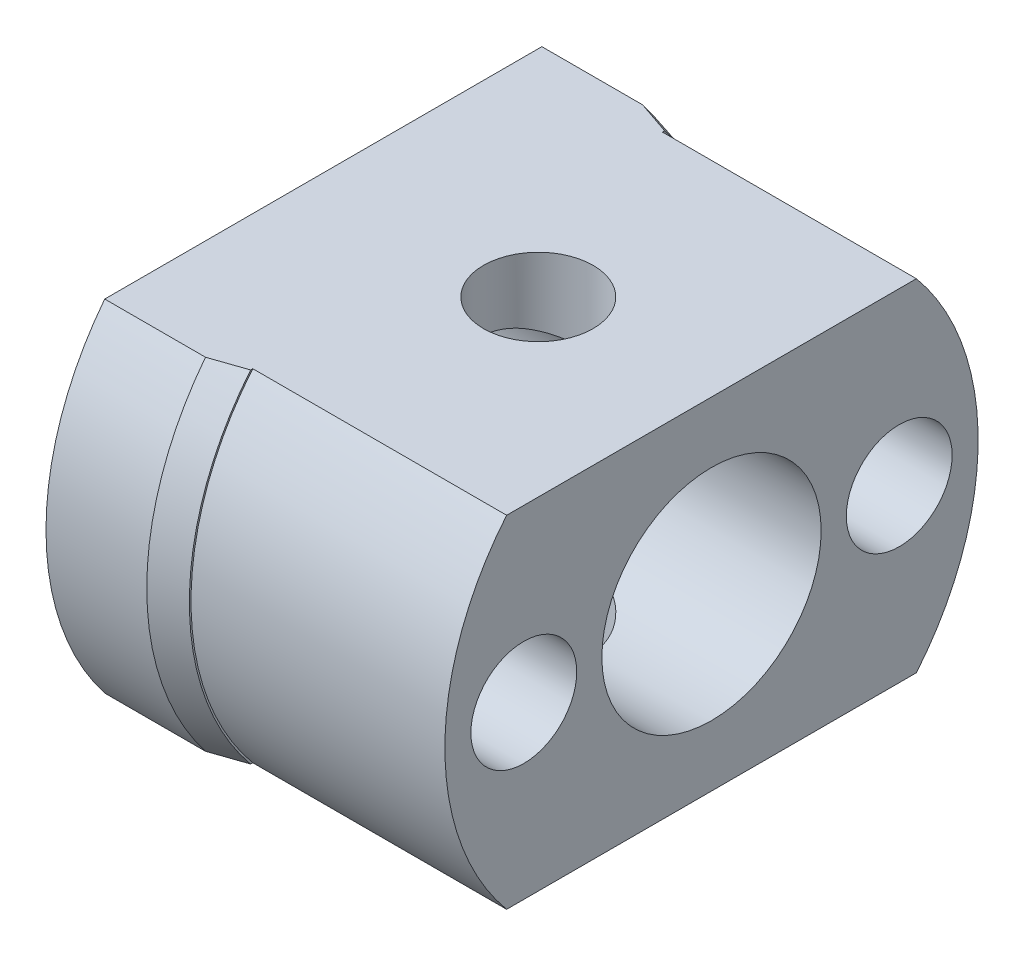
from build123d import *

# Parameters (mm, degrees)
SKETCH1_R                 = 7.9375
SKETCH1_R_2               = 1.575
SKETCH1_R_3               = 3.2639
INNER_SIDE_EXTRUDE_DEPTH  = 2.032
OUTER_START               = -9.525
SKETCH1_3_R               = 7.9375
SKETCH1_3_R_2             = 1.575
SKETCH1_3_R_3             = 3.2639
OUTER_SIDE_EXTRUDE_DEPTH  = 9.525
CLEVIS_PIN_CUT_DEPTH      = 15.721869362
CLEVIS_PIN_CUT_DEPTH_BACK = 15.721869362
SKETCH2_R                 = 1.63195
SKETCH3_R                 = 8.255
SKETCH3_R_2               = 7.9375
BOSS_EXTRUDE1_DEPTH       = 4
SKETCH4_R                 = 1.575
CUT_EXTRUDE1_DEPTH        = 4
CHAMFER1_SIZE             = 1
CHAMFER1_SIZE2            = 0.267949192
CUT_EXTRUDE2_DEPTH        = 16.067039421
CUT_EXTRUDE2_DEPTH_BACK   = 16.067039421
SKETCH5_W                 = 16.51
SKETCH5_H                 = 4.312866645


with BuildPart() as part:
    # Sketch1 → Inner Side Extrude (new body)
    with BuildSketch(Plane(origin=(0, 0, 0), x_dir=(0, 0, -1), z_dir=(1, 0, 0))):
        Circle(SKETCH1_R)
        with Locations((5.588, 0)):
            Circle(SKETCH1_R_2, mode=Mode.SUBTRACT)
        with Locations((-5.588, 0)):
            Circle(SKETCH1_R_2, mode=Mode.SUBTRACT)
        Circle(SKETCH1_R_3, mode=Mode.SUBTRACT)
    extrude(amount=INNER_SIDE_EXTRUDE_DEPTH)

    # Sketch1<3> → Outer Side Extrude (add)
    with BuildSketch(Plane(origin=(0, 0, 0), x_dir=(0, 0, -1), z_dir=(1, 0, 0)).offset(OUTER_START)):
        Circle(SKETCH1_3_R)
        with Locations((5.588, 0)):
            Circle(SKETCH1_3_R_2, mode=Mode.SUBTRACT)
        with Locations((-5.588, 0)):
            Circle(SKETCH1_3_R_2, mode=Mode.SUBTRACT)
        Circle(SKETCH1_3_R_3, mode=Mode.SUBTRACT)
    extrude(amount=OUTER_SIDE_EXTRUDE_DEPTH)

    # Sketch2 → Clevis Pin Cut (cut, two sides: drawn at the far end of the back side and taken through both)
    with BuildSketch(Plane(origin=(0, 0, 0), x_dir=(1, 0, 0), z_dir=(0, 1, 0)).offset(-CLEVIS_PIN_CUT_DEPTH_BACK)):
        with Locations((-3.1242, 0)):
            Circle(SKETCH2_R)
    extrude(amount=CLEVIS_PIN_CUT_DEPTH + CLEVIS_PIN_CUT_DEPTH_BACK, mode=Mode.SUBTRACT)

    # Sketch3 → Boss-Extrude1 (add)
    with BuildSketch(Plane(origin=(-9.525, 0, 0), x_dir=(0, 0, -1), z_dir=(1, 0, 0))):
        Circle(SKETCH3_R)
        Circle(SKETCH3_R_2, mode=Mode.SUBTRACT)
    extrude(amount=BOSS_EXTRUDE1_DEPTH)

    # Sketch4 → Cut-Extrude1 (cut)
    # profile 1 of 2: a face of its own
    with BuildSketch(Plane(origin=(-9.525, 0, 0), x_dir=(0, 0, -1), z_dir=(1, 0, 0))):
        Polygon((-3.338, 1.299038106), (-5.588, 2.598076211), (-7.838, 1.299038106), (-7.838, -1.299038106), (-5.588, -2.598076211), (-3.338, -1.299038106), align=None)
        with Locations((-5.588, 0)):
            Circle(SKETCH4_R, mode=Mode.SUBTRACT)
    # profile 2 of 2: a face of its own
    with BuildSketch(Plane(origin=(-9.525, 0, 0), x_dir=(0, 0, -1), z_dir=(1, 0, 0))):
        Polygon((5.588, 2.598076211), (3.338, 1.299038106), (3.338, -1.299038106), (5.588, -2.598076211), (7.838, -1.299038106), (7.838, 1.299038106), align=None)
        with Locations((5.588, 0)):
            Circle(SKETCH4_R, mode=Mode.SUBTRACT)
    extrude(amount=CUT_EXTRUDE1_DEPTH, mode=Mode.SUBTRACT)

    # Chamfer1
    chamfer1_edges = [part.edges().sort_by_distance(p)[0] for p in [
        (-5.525, 0, 8.255),
    ]]
    chamfer1_side = [part.faces().sort_by_distance(p)[0] for p in [
        (-7.525, 0, 8.255),
    ]]
    chamfer(chamfer1_edges, length=CHAMFER1_SIZE, length2=CHAMFER1_SIZE2, reference=chamfer1_side[0])

    # Sketch5 → Cut-Extrude2 (cut, two sides: drawn at the far end of the back side and taken through both)
    with BuildSketch(Plane.XY.offset(-CUT_EXTRUDE2_DEPTH_BACK)):
        with Locations((-3.1242, 7.236433322)):
            Rectangle(SKETCH5_W, SKETCH5_H)
        with Locations((-3.1242, -7.236433322)):
            Rectangle(SKETCH5_W, SKETCH5_H)
    extrude(amount=CUT_EXTRUDE2_DEPTH + CUT_EXTRUDE2_DEPTH_BACK, mode=Mode.SUBTRACT)


solid = part.part
